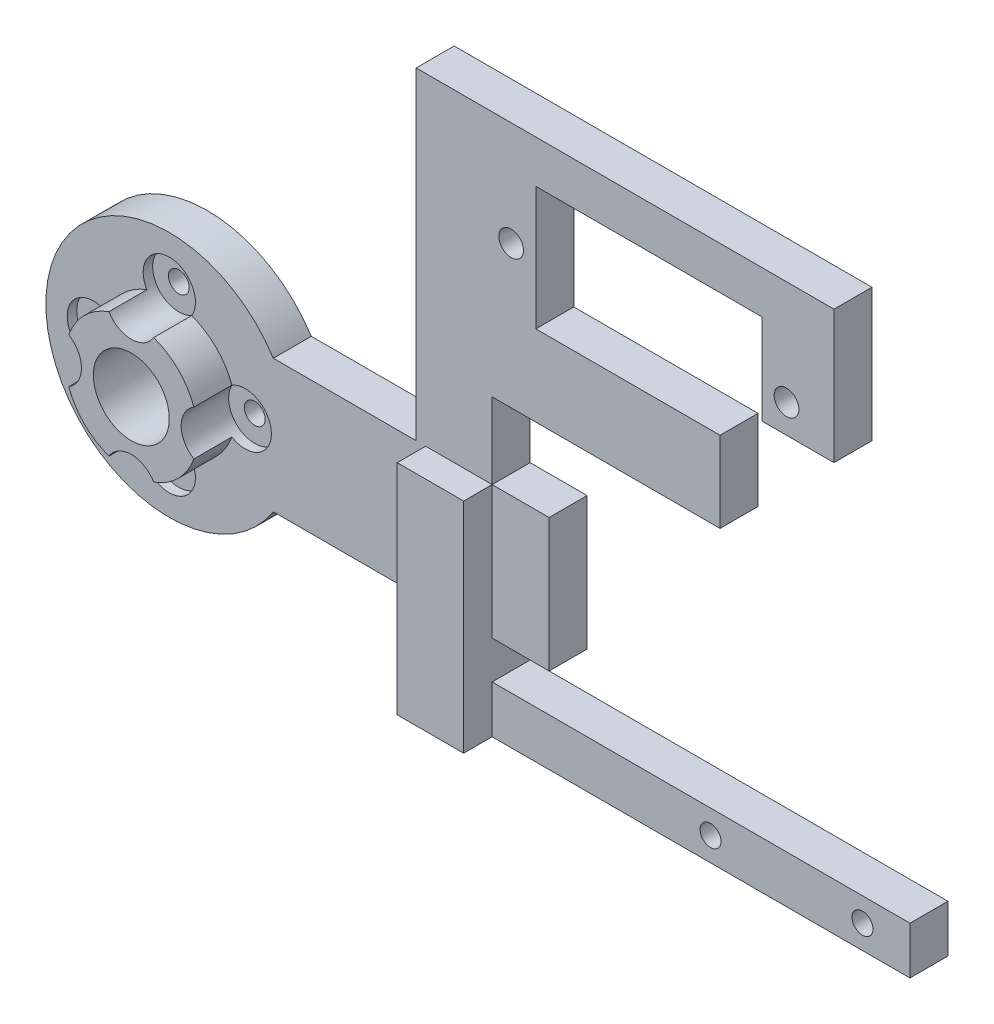
from build123d import *

# Parameters (mm, degrees)
ELBOW_HORN_FLANGE_PROFILE_R          = 13
ELBOW_HORN_FLANGE_DEPTH              = 4
FOREARM_WEB_PROFILE_W                = 40
FOREARM_WEB_PROFILE_H                = 14
FOREARM_WEB_DEPTH                    = 4
GRIPPER_MOUNT_RIB_PROFILE_W          = 8
GRIPPER_MOUNT_RIB_PROFILE_H          = 30
GRIPPER_MOUNT_RIB_DEPTH              = 4
GRIPPER_SERVO_MOUNT_PROFILE_W        = 44
GRIPPER_SERVO_MOUNT_PROFILE_H        = 26
GRIPPER_SERVO_MOUNT_DEPTH            = 4
GRIP_SG90_BODY_CLEARANCE_START       = -5
GRIP_SG90_BODY_CLEARANCE_PROFILE_W   = 23.8
GRIP_SG90_BODY_CLEARANCE_PROFILE_H   = 13
GRIP_SG90_BODY_CLEARANCE_DEPTH       = 87.221918224
MOVING_FINGER_SWEEP_RELIEF_START     = -5
MOVING_FINGER_SWEEP_RELIEF_PROFILE_W = 13
MOVING_FINGER_SWEEP_RELIEF_PROFILE_H = 13
MOVING_FINGER_SWEEP_RELIEF_DEPTH     = 87.221918224
GRIP_SERVO_TAB_FASTENERS_START       = -50
GRIP_SERVO_TAB_FASTENERS_PROFILE_R   = 1.3
GRIP_SERVO_TAB_FASTENERS_DEPTH       = 132.221918224
FIXED_FINGER_SPINE_PROFILE_W         = 48
FIXED_FINGER_SPINE_PROFILE_H         = 5
FIXED_FINGER_SPINE_DEPTH             = 4
FIXED_FINGER_ROOT_PROFILE_W          = 7
FIXED_FINGER_ROOT_PROFILE_H          = 23
FIXED_FINGER_ROOT_DEPTH              = 7
ELBOW_CENTER_SCREW_ACCESS_START      = -50
ELBOW_CENTER_SCREW_ACCESS_PROFILE_R  = 4
ELBOW_CENTER_SCREW_ACCESS_DEPTH      = 139.396832522
ELBOW_DOWEL_SUPPORT_HUB_START        = 4
ELBOW_DOWEL_SUPPORT_HUB_PROFILE_R    = 7
ELBOW_DOWEL_SUPPORT_HUB_PROFILE_R_2  = 4
ELBOW_DOWEL_SUPPORT_HUB_DEPTH        = 4
ELBOW_HORN_FASTENERS_START           = -50
ELBOW_HORN_FASTENERS_PROFILE_R       = 1.1
ELBOW_HORN_FASTENERS_DEPTH           = 139.481636513
M2X8_WASHER_AND_HUB_CLEARANCE_START  = 3
ELBOW_HORN_WASHER_RECESS_PROFILE_R   = 2.75
M2X8_WASHER_AND_HUB_CLEARANCE_DEPTH  = 5
FIXED_PAD_KEEPER_FASTENERS_START     = -50
FIXED_PAD_KEEPER_FASTENERS_PROFILE_R = 1.1
FIXED_PAD_KEEPER_FASTENERS_DEPTH     = 139.481636513


with BuildPart() as part:
    # Elbow_horn_flange_profile → Elbow_horn_flange (new body)
    with BuildSketch(Plane.XY):
        Circle(ELBOW_HORN_FLANGE_PROFILE_R)
    extrude(amount=ELBOW_HORN_FLANGE_DEPTH)

    # Forearm_web_profile → Forearm_web (add)
    with BuildSketch(Plane.XY):
        with Locations((20, 0)):
            Rectangle(FOREARM_WEB_PROFILE_W, FOREARM_WEB_PROFILE_H)
    extrude(amount=FOREARM_WEB_DEPTH)

    # Gripper_mount_rib_profile → Gripper_mount_rib (add)
    with BuildSketch(Plane.XY):
        with Locations((30, 15)):
            Rectangle(GRIPPER_MOUNT_RIB_PROFILE_W, GRIPPER_MOUNT_RIB_PROFILE_H)
    extrude(amount=GRIPPER_MOUNT_RIB_DEPTH)

    # Gripper_servo_mount_profile → Gripper_servo_mount (add)
    with BuildSketch(Plane.XY):
        with Locations((48, 28)):
            Rectangle(GRIPPER_SERVO_MOUNT_PROFILE_W, GRIPPER_SERVO_MOUNT_PROFILE_H)
    extrude(amount=GRIPPER_SERVO_MOUNT_DEPTH)

    # Grip_SG90_body_clearance_profile → Grip_SG90_body_clearance (cut, through all)
    with BuildSketch(Plane.XY.offset(GRIP_SG90_BODY_CLEARANCE_START)):
        with Locations((50.5, 30)):
            Rectangle(GRIP_SG90_BODY_CLEARANCE_PROFILE_W, GRIP_SG90_BODY_CLEARANCE_PROFILE_H)
    extrude(amount=GRIP_SG90_BODY_CLEARANCE_DEPTH, mode=Mode.SUBTRACT)

    # Moving_finger_sweep_relief_profile → Moving_finger_sweep_relief (cut, through all)
    with BuildSketch(Plane.XY.offset(MOVING_FINGER_SWEEP_RELIEF_START)):
        with Locations((64.5, 20.5)):
            Rectangle(MOVING_FINGER_SWEEP_RELIEF_PROFILE_W, MOVING_FINGER_SWEEP_RELIEF_PROFILE_H)
    extrude(amount=MOVING_FINGER_SWEEP_RELIEF_DEPTH, mode=Mode.SUBTRACT)

    # Grip_servo_tab_fasteners_profile → Grip_servo_tab_fasteners (cut, through all)
    with BuildSketch(Plane.XY.offset(GRIP_SERVO_TAB_FASTENERS_START)):
        with Locations((36, 30)):
            Circle(GRIP_SERVO_TAB_FASTENERS_PROFILE_R)
        with Locations((65, 30)):
            Circle(GRIP_SERVO_TAB_FASTENERS_PROFILE_R)
    extrude(amount=GRIP_SERVO_TAB_FASTENERS_DEPTH, mode=Mode.SUBTRACT)



with BuildPart() as body_2:
    # Fixed_finger_spine_profile → Fixed_finger_spine (new body)
    with BuildSketch(Plane.XY):
        with Locations((54, -13.5)):
            Rectangle(FIXED_FINGER_SPINE_PROFILE_W, FIXED_FINGER_SPINE_PROFILE_H)
    extrude(amount=FIXED_FINGER_SPINE_DEPTH)


with BuildPart() as part_1:
    add(part.part)

    add(body_2.part)  # Fixed_finger_root merges body 2
    # Fixed_finger_root_profile → Fixed_finger_root (add)
    with BuildSketch(Plane.XY):
        with Locations((30.5, -4.5)):
            Rectangle(FIXED_FINGER_ROOT_PROFILE_W, FIXED_FINGER_ROOT_PROFILE_H)
    extrude(amount=FIXED_FINGER_ROOT_DEPTH)

    # Elbow_center_screw_access_profile → Elbow_center_screw_access (cut, through all)
    with BuildSketch(Plane.XY.offset(ELBOW_CENTER_SCREW_ACCESS_START)):
        with Locations(Location((0, 0, 0), (0, 0, 180))):
            Circle(ELBOW_CENTER_SCREW_ACCESS_PROFILE_R)
    extrude(amount=ELBOW_CENTER_SCREW_ACCESS_DEPTH, mode=Mode.SUBTRACT)

    # Elbow_dowel_support_hub_profile → Elbow_dowel_support_hub (add)
    with BuildSketch(Plane.XY.offset(ELBOW_DOWEL_SUPPORT_HUB_START)):
        Circle(ELBOW_DOWEL_SUPPORT_HUB_PROFILE_R)
        with Locations(Location((0, 0, 0), (0, 0, 180))):
            Circle(ELBOW_DOWEL_SUPPORT_HUB_PROFILE_R_2, mode=Mode.SUBTRACT)
    extrude(amount=ELBOW_DOWEL_SUPPORT_HUB_DEPTH)

    # Elbow_horn_fasteners_profile → Elbow_horn_fasteners (cut, through all)
    with BuildSketch(Plane.XY.offset(ELBOW_HORN_FASTENERS_START)):
        with Locations(Location((0, -8, 0), (0, 0, 112.9239414))):
            Circle(ELBOW_HORN_FASTENERS_PROFILE_R)
        with Locations(Location((0, 8, 0), (0, 0, 247.0760586))):
            Circle(ELBOW_HORN_FASTENERS_PROFILE_R)
        with Locations(Location((-8, 0, 0), (0, 0, 22.9239414))):
            Circle(ELBOW_HORN_FASTENERS_PROFILE_R)
        with Locations(Location((8, 0, 0), (0, 0, 157.0760586))):
            Circle(ELBOW_HORN_FASTENERS_PROFILE_R)
    extrude(amount=ELBOW_HORN_FASTENERS_DEPTH, mode=Mode.SUBTRACT)

    # Elbow_horn_washer_recess_profile → M2x8_washer_and_hub_clearance (cut)
    with BuildSketch(Plane.XY.offset(M2X8_WASHER_AND_HUB_CLEARANCE_START)):
        with Locations(Location((0, -8, 0), (0, 0, 149.150544772))):
            Circle(ELBOW_HORN_WASHER_RECESS_PROFILE_R)
        with Locations(Location((0, 8, 0), (0, 0, 210.849455228))):
            Circle(ELBOW_HORN_WASHER_RECESS_PROFILE_R)
        with Locations(Location((-8, 0, 0), (0, 0, 59.150544772))):
            Circle(ELBOW_HORN_WASHER_RECESS_PROFILE_R)
        with Locations(Location((8, 0, 0), (0, 0, 120.849455228))):
            Circle(ELBOW_HORN_WASHER_RECESS_PROFILE_R)
    extrude(amount=M2X8_WASHER_AND_HUB_CLEARANCE_DEPTH, mode=Mode.SUBTRACT)

    # Fixed_pad_keeper_fasteners_profile → Fixed_pad_keeper_fasteners (cut, through all)
    with BuildSketch(Plane.XY.offset(FIXED_PAD_KEEPER_FASTENERS_START)):
        with Locations(Location((57, -13.5, 0), (0, 0, 180))):
            Circle(FIXED_PAD_KEEPER_FASTENERS_PROFILE_R)
        with Locations(Location((73, -13.5, 0), (0, 0, 180))):
            Circle(FIXED_PAD_KEEPER_FASTENERS_PROFILE_R)
    extrude(amount=FIXED_PAD_KEEPER_FASTENERS_DEPTH, mode=Mode.SUBTRACT)


solid = part_1.part
